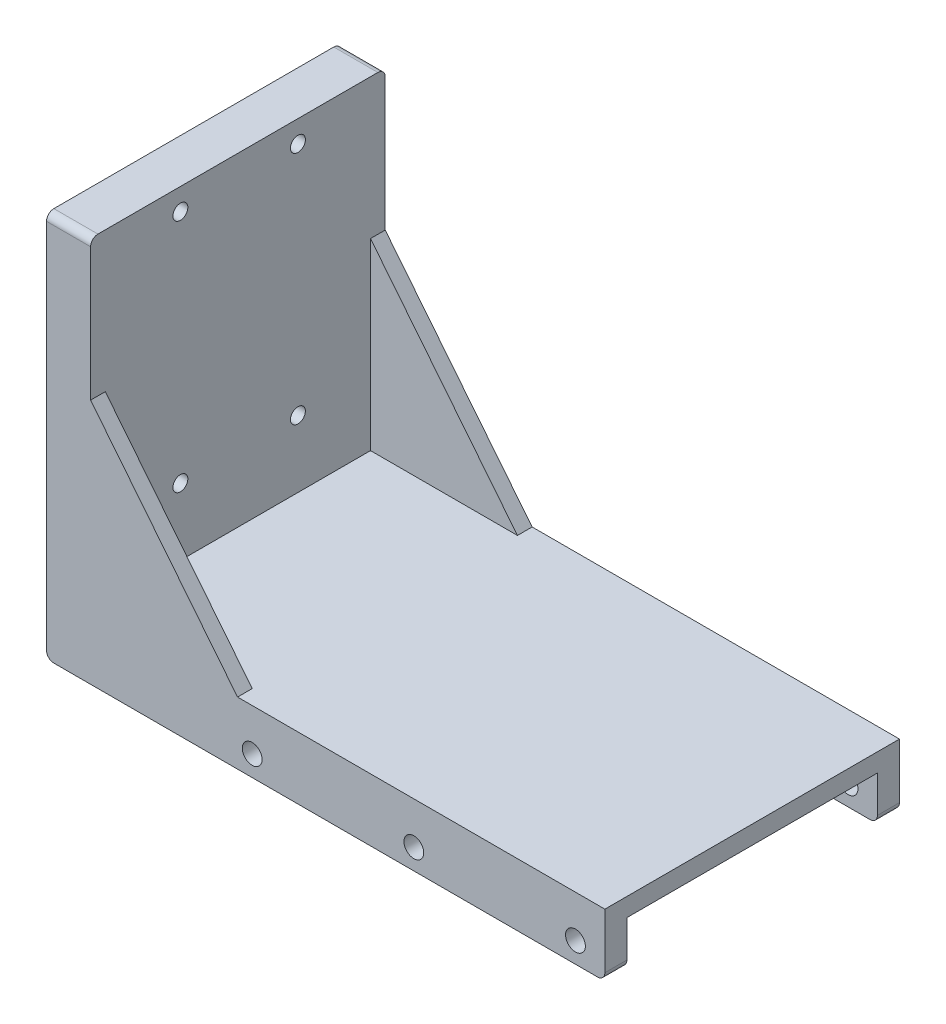
from build123d import *

# Parameters (mm, degrees)
BOSS_EXTRUDE1_DEPTH = 40.1
SKETCH3_R           = 1.35
CUT_EXTRUDE2_DEPTH  = 50.8
SKETCH4_R           = 1.016
CUT_EXTRUDE3_DEPTH  = 50.8
SKETCH6_W           = 62.086073973
SKETCH6_H           = 34.1
CUT_EXTRUDE4_DEPTH  = 6
BOSS_EXTRUDE5_DEPTH = 2
FILLET1_R           = 1


with BuildPart() as part:
    # Sketch1 → Boss-Extrude1 (new body)
    with BuildSketch(Plane.XY):
        Polygon((0, 0), (0, 52.578), (6, 52.578), (6, 8.5), (76, 8.5), (76, 0), align=None)
    extrude(amount=BOSS_EXTRUDE1_DEPTH)

    # Sketch3 → Cut-Extrude2 (cut)
    with BuildSketch(Plane.XY.offset(40.1)):
        with Locations((27.996, 2.8)):
            Circle(SKETCH3_R)
        with Locations((49.996, 2.8)):
            Circle(SKETCH3_R)
        with Locations((71.996, 2.8)):
            Circle(SKETCH3_R)
    extrude(amount=-CUT_EXTRUDE2_DEPTH, mode=Mode.SUBTRACT)

    # Sketch4 → Cut-Extrude3 (cut)
    with BuildSketch(Plane.ZY):
        with Locations((27.88, 17.6)):
            Circle(SKETCH4_R)
        with Locations(Location((11.88, 17.6, 0), (0, 0, 270))):
            Circle(SKETCH4_R)
        with Locations((27.88, 49.6)):
            Circle(SKETCH4_R)
        with Locations(Location((11.88, 49.6, 0), (0, 0, 270))):
            Circle(SKETCH4_R)
    extrude(amount=-CUT_EXTRUDE3_DEPTH, mode=Mode.SUBTRACT)

    # Sketch6 → Cut-Extrude4 (cut)
    with BuildSketch(Plane.XZ):
        with Locations((50.043036987, 20.05)):
            Rectangle(SKETCH6_W, SKETCH6_H)
    extrude(amount=-CUT_EXTRUDE4_DEPTH, mode=Mode.SUBTRACT)

    # Sketch16 → Boss-Extrude5 (add)
    with BuildSketch(Plane.XY.offset(40.1)):
        Polygon((6, 8.5), (26, 8.5), (6, 33.5), align=None)
    boss_extrude5 = extrude(amount=-BOSS_EXTRUDE5_DEPTH)

    # Mirror2: Boss-Extrude5 across plane
    add(boss_extrude5.mirror(Plane(origin=(0, 0, 20.05), x_dir=(1, 0, 0), z_dir=(0, 0, -1))))

    # Fillet1
    fillet1_edges = [part.edges().sort_by_distance(p)[0] for p in [
        (0, 0, 20.05),
        (76, 0, 38.6),
        (3, 52.578, 40.1),
        (76, 0, 1.5),
        (3, 52.578, 0),
    ]]
    fillet(fillet1_edges, radius=FILLET1_R)


solid = part.part
